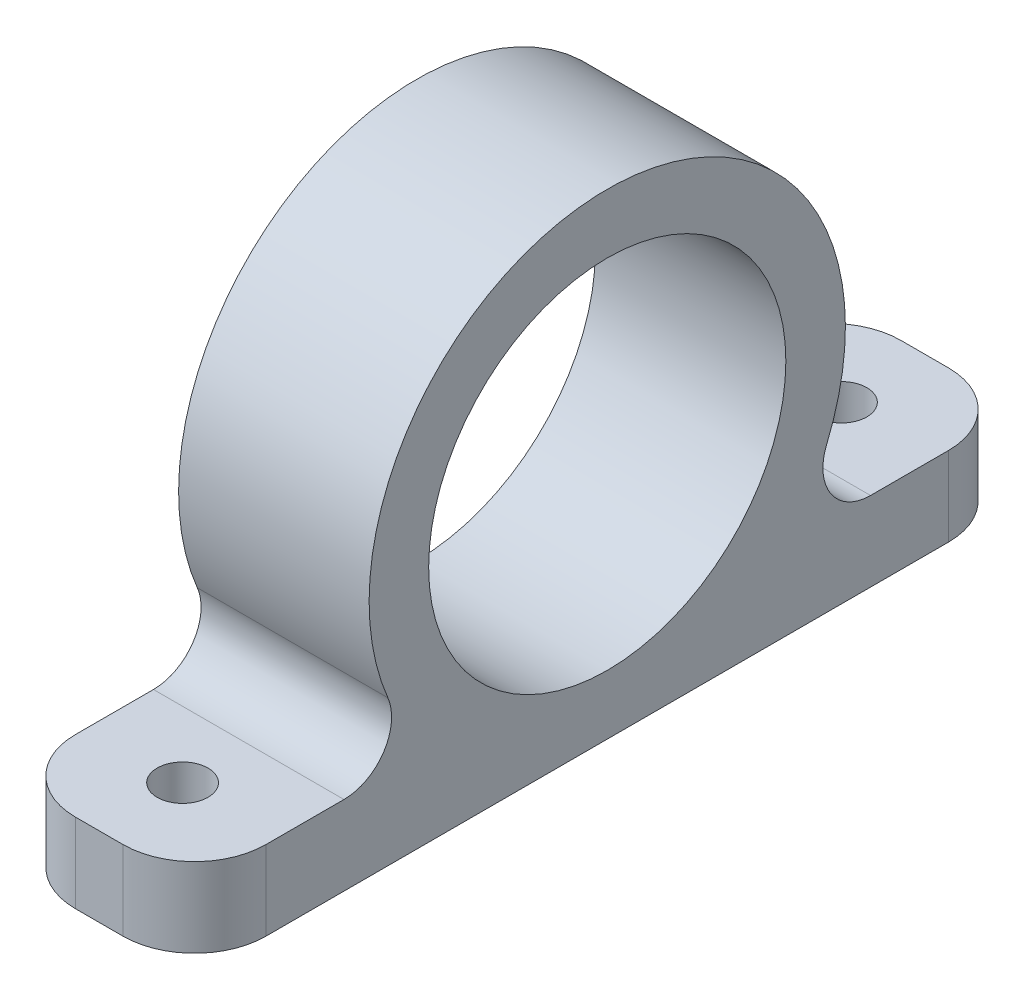
from build123d import *

# Parameters (mm, degrees)
SALIENTE_EXTRUIR1_DEPTH    = 12
CROQUIS2_R                 = 11.25
CORTAR_EXTRUIR1_DEPTH      = 33.32645975
REDONDEO1_R                = 3
REDONDEO2_R                = 4.5
CORTAR_EXTRUIR2_DEPTH      = 10
CORTAR_EXTRUIR2_DEPTH_BACK = 39.013155617
CROQUIS3_R                 = 1.6


with BuildPart() as part:
    # Croquis1 → Saliente-Extruir1 (new body)
    with BuildSketch(Plane(origin=(0, 0, 0), x_dir=(0, 0, -1), z_dir=(1, 0, 0))):
        with BuildLine():
            Line((-26, -15), (26, -15))
            Line((26, -15), (26, -10))
            Line((26, -10), (11.180339887, -10))
            ThreePointArc((11.180339887, -10), (0, 15), (-11.180339887, -10))
            Line((-11.180339887, -10), (-26, -10))
            Line((-26, -10), (-26, -15))
        make_face()
    extrude(amount=SALIENTE_EXTRUIR1_DEPTH)

    # Croquis2 → Cortar-Extruir1 (cut, through all)
    with BuildSketch(Plane.ZY):
        Circle(CROQUIS2_R)
    extrude(amount=-CORTAR_EXTRUIR1_DEPTH, mode=Mode.SUBTRACT)

    # Redondeo1
    redondeo1_edges = [part.edges().sort_by_distance(p)[0] for p in [
        (6, -10, 11.180339887),
        (6, -10, -11.180339887),
    ]]
    fillet(redondeo1_edges, radius=REDONDEO1_R)

    # Redondeo2
    redondeo2_edges = [part.edges().sort_by_distance(p)[0] for p in [
        (12, -12.5, -26),
        (0, -12.5, -26),
        (0, -12.5, 26),
        (12, -12.5, 26),
    ]]
    fillet(redondeo2_edges, radius=REDONDEO2_R)

    # Croquis3 → Cortar-Extruir2 (cut, two sides: drawn at the far end of the back side and taken through both)
    with BuildSketch(Plane(origin=(0, -10, 0), x_dir=(1, 0, 0), z_dir=(0, 1, 0)).offset(-CORTAR_EXTRUIR2_DEPTH_BACK)):
        with Locations((6, 20.75)):
            Circle(CROQUIS3_R)
        with Locations((6, -20.75)):
            Circle(CROQUIS3_R)
    extrude(amount=CORTAR_EXTRUIR2_DEPTH + CORTAR_EXTRUIR2_DEPTH_BACK, mode=Mode.SUBTRACT)


solid = part.part
